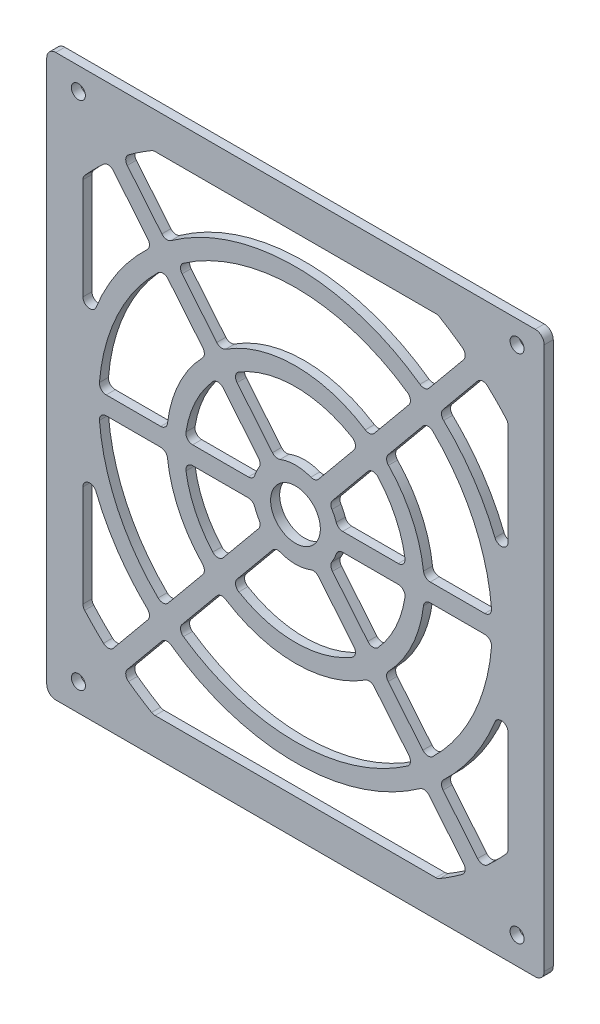
from build123d import *

# Parameters (mm, degrees)
SKETCH_1_W          = 110
SKETCH_1_H          = 124
EXTRUDE_1_DEPTH     = 2
SKETCH_3_R          = 1.55
CUT_EXTRUDE_1_DEPTH = 10
FILLET_2_R          = 2
SKETCH_5_R          = 43.5
SKETCH_5_R_2        = 28.5
SKETCH_5_R_3        = 24.5
SKETCH_5_R_4        = 9.5
SKETCH_5_R_5        = 5.5
CUT_EXTRUDE_4_DEPTH = 2
EXTRUDE_2_DEPTH     = 2
FILLET_3_R          = 1.5


with BuildPart() as part:
    # 草图1 → 凸台-拉伸1 (new body)
    with BuildSketch(Plane.XY):
        Rectangle(SKETCH_1_W, SKETCH_1_H)
    extrude(amount=EXTRUDE_1_DEPTH)

    # 草图3 → 切除-拉伸1 (cut)
    with BuildSketch(Plane.XY.offset(2)):
        with Locations((49, 57)):
            Circle(SKETCH_3_R)
        with Locations((-48, 57)):
            Circle(SKETCH_3_R)
        with Locations((-48, -56)):
            Circle(SKETCH_3_R)
        with Locations((49, -56)):
            Circle(SKETCH_3_R)
    extrude(amount=-CUT_EXTRUDE_1_DEPTH, mode=Mode.SUBTRACT)

    # 圆角2
    fillet_2_edges = [part.edges().sort_by_distance(p)[0] for p in [
        (55, -62, 1),
        (-55, -62, 1),
        (-55, 62, 1),
        (55, 62, 1),
    ]]
    fillet(fillet_2_edges, radius=FILLET_2_R)

    # 草图5 → 切除-拉伸4 (cut)
    # profile 1 of 5: a face of its own
    with BuildSketch(Plane.XY.offset(2)):
        with BuildLine():
            ThreePointArc((-31.468237955, 54), (-39.752872235, 48.228198692), (-47, 41.19769411))
            Line((-47, 41.19769411), (-47, 6.873863542))
            ThreePointArc((-47, 6.873863542), (0, 47.5), (47, 6.873863542))
            Line((47, 6.873863542), (47, 41.19769411))
            ThreePointArc((47, 41.19769411), (39.752872235, 48.228198692), (31.468237955, 54))
            Line((31.468237955, 54), (-31.468237955, 54))
        make_face()
    # profile 2 of 5: a face of its own
    with BuildSketch(Plane.XY.offset(2)):
        Circle(SKETCH_5_R)
        Circle(SKETCH_5_R_2, mode=Mode.SUBTRACT)
    # profile 3 of 5: a face of its own
    with BuildSketch(Plane.XY.offset(2)):
        Circle(SKETCH_5_R_3)
        Circle(SKETCH_5_R_4, mode=Mode.SUBTRACT)
    # profile 4 of 5: a face of its own
    with BuildSketch(Plane.XY.offset(2)):
        with BuildLine():
            Line((-47, -6.873863542), (-47, -41.19769411))
            ThreePointArc((-47, -41.19769411), (-39.752872235, -48.228198692), (-31.468237955, -54))
            Line((-31.468237955, -54), (31.468237955, -54))
            ThreePointArc((31.468237955, -54), (39.752872235, -48.228198692), (47, -41.19769411))
            Line((47, -41.19769411), (47, -6.873863542))
            ThreePointArc((47, -6.873863542), (0, -47.5), (-47, -6.873863542))
        make_face()
    # profile 5 of 5: a face of its own
    with BuildSketch(Plane.XY.offset(2)):
        Circle(SKETCH_5_R_5)
    extrude(amount=-CUT_EXTRUDE_4_DEPTH, mode=Mode.SUBTRACT)


with BuildPart() as cut_extrude_4_piece_1:
    # of the separate pieces the step leaves, piece 1, a body of its own (cut_extrude_4_pieces)
    add(part.part.solids().sort_by_distance((-53, -62, 0))[0])



with BuildPart() as cut_extrude_4_piece_2:
    # of the separate pieces the step leaves, piece 2, a body of its own (cut_extrude_4_pieces)
    add(part.part.solids().sort_by_distance((28.5, 0, 0))[0])


with BuildPart() as cut_extrude_4_piece_3:
    # of the separate pieces the step leaves, piece 3, a body of its own (cut_extrude_4_pieces)
    add(part.part.solids().sort_by_distance((9.5, 0, 0))[0])


with BuildPart() as cut_extrude_4_piece_1_1:
    add(cut_extrude_4_piece_1.part)

    add(cut_extrude_4_piece_2.part)  # 凸台-拉伸2 merges 切除-拉伸4 piece 2

    add(cut_extrude_4_piece_3.part)  # 凸台-拉伸2 merges 切除-拉伸4 piece 3
    # 草图6 → 凸台-拉伸2 (add)
    with BuildSketch(Plane.XY.offset(2)):
        with BuildLine():
            ThreePointArc((-29.182042471, -32.259237394), (-27.667999076, -33.566826289), (-26.095437755, -34.803421217))
            Line((-26.095437755, -34.803421217), (-1.715463439, -5.225627732))
            ThreePointArc((-1.715463439, -5.225627732), (-3.498252757, -4.244081485), (-4.802068155, -2.681443909))
            Line((-4.802068155, -2.681443909), (-29.182042471, -32.259237394))
        make_face()
        with BuildLine():
            ThreePointArc((-41.27581591, -46.931407618), (-39.752872235, -48.228198692), (-38.189211194, -49.475591441))
            Line((-38.189211194, -49.475591441), (-28.642087778, -37.893017928))
            ThreePointArc((-28.642087778, -37.893017928), (-30.212182899, -36.653431006), (-31.728692495, -35.348834105))
            Line((-31.728692495, -35.348834105), (-41.27581591, -46.931407618))
        make_face()
        with BuildLine():
            ThreePointArc((-43.453998665, 2), (-43.5, 0), (-43.453998665, -2))
            Line((-43.453998665, -2), (-5.5, -2))
            Line((-5.5, -2), (-5.5, 0))
            Line((-5.5, 0), (-5.5, 2))
            Line((-5.5, 2), (-43.453998665, 2))
        make_face()
        with BuildLine():
            Line((5.5, -2), (43.453998665, -2))
            ThreePointArc((43.453998665, -2), (43.488498146, -1.00026448), (43.5, 0))
            ThreePointArc((43.5, 0), (43.488498146, 1.00026448), (43.453998665, 2))
            Line((43.453998665, 2), (5.5, 2))
            Line((5.5, 2), (5.5, 0))
            Line((5.5, 0), (5.5, -2))
        make_face()
        with BuildLine():
            Line((1.715463439, -5.225627732), (26.095437755, -34.803421217))
            ThreePointArc((26.095437755, -34.803421217), (27.667999076, -33.566826289), (29.182042471, -32.259237394))
            Line((29.182042471, -32.259237394), (4.802068155, -2.681443909))
            ThreePointArc((4.802068155, -2.681443909), (3.498252757, -4.244081485), (1.715463439, -5.225627732))
        make_face()
        with BuildLine():
            ThreePointArc((31.728692495, -35.348834105), (30.212182899, -36.653431006), (28.642087778, -37.893017928))
            Line((28.642087778, -37.893017928), (38.189211194, -49.475591441))
            ThreePointArc((38.189211194, -49.475591441), (39.752872235, -48.228198692), (41.27581591, -46.931407618))
            Line((41.27581591, -46.931407618), (31.728692495, -35.348834105))
        make_face()
        with BuildLine():
            ThreePointArc((1.715463439, 5.225627732), (3.498252757, 4.244081485), (4.802068155, 2.681443909))
            Line((4.802068155, 2.681443909), (29.182042471, 32.259237394))
            ThreePointArc((29.182042471, 32.259237394), (27.667999076, 33.566826289), (26.095437755, 34.803421217))
            Line((26.095437755, 34.803421217), (1.715463439, 5.225627732))
        make_face()
        with BuildLine():
            ThreePointArc((28.642087778, 37.893017928), (30.212182899, 36.653431006), (31.728692495, 35.348834105))
            Line((31.728692495, 35.348834105), (41.27581591, 46.931407618))
            ThreePointArc((41.27581591, 46.931407618), (39.752872235, 48.228198692), (38.189211194, 49.475591441))
            Line((38.189211194, 49.475591441), (28.642087778, 37.893017928))
        make_face()
        with BuildLine():
            Line((-29.182042471, 32.259237394), (-4.802068155, 2.681443909))
            ThreePointArc((-4.802068155, 2.681443909), (-3.498252757, 4.244081485), (-1.715463439, 5.225627732))
            Line((-1.715463439, 5.225627732), (-26.095437755, 34.803421217))
            ThreePointArc((-26.095437755, 34.803421217), (-27.667999076, 33.566826289), (-29.182042471, 32.259237394))
        make_face()
        with BuildLine():
            Line((-41.27581591, 46.931407618), (-31.728692495, 35.348834105))
            ThreePointArc((-31.728692495, 35.348834105), (-30.212182899, 36.653431006), (-28.642087778, 37.893017928))
            Line((-28.642087778, 37.893017928), (-38.189211194, 49.475591441))
            ThreePointArc((-38.189211194, 49.475591441), (-39.752872235, 48.228198692), (-41.27581591, 46.931407618))
        make_face()
    extrude(amount=-EXTRUDE_2_DEPTH)

    # 圆角3
    fillet_3_edges = [cut_extrude_4_piece_1_1.edges().sort_by_distance(p)[0] for p in [
        (-9.287087811, -2, 1),
        (-9.287087811, 2, 1),
        (-24.418230894, 2, 1),
        (-28.429737952, -2, 1),
        (-24.418230894, -2, 1),
        (-28.429737952, 2, 1),
        (-43.453998665, 2, 1),
        (-43.453998665, -2, 1),
        (9.287087811, 2, 1),
        (9.287087811, -2, 1),
        (24.418230894, -2, 1),
        (28.429737952, 2, 1),
        (24.418230894, 2, 1),
        (28.429737952, -2, 1),
        (43.453998665, -2, 1),
        (43.453998665, 2, 1),
        (7.450317001, -5.894300348, 1),
        (4.363712285, -8.438484171, 1),
        (13.987814649, -20.114448572, 1),
        (19.625922206, -20.665748899, 1),
        (17.074419365, -17.570264749, 1),
        (16.53931749, -23.209932722, 1),
        (26.095437755, -34.803421217, 1),
        (29.182042471, -32.259237394, 1),
        (38.189211194, -49.475591441, 1),
        (41.27581591, -46.931407618, 1),
        (31.728692495, -35.348834105, 1),
        (28.642087778, -37.893017928, 1),
        (17.074419365, 17.570264749, 1),
        (7.450317001, 5.894300348, 1),
        (16.53931749, 23.209932722, 1),
        (13.987814649, 20.114448572, 1),
        (4.363712285, 8.438484171, 1),
        (19.625922206, 20.665748899, 1),
        (29.182042471, 32.259237394, 1),
        (26.095437755, 34.803421217, 1),
        (28.642087778, 37.893017928, 1),
        (38.189211194, 49.475591441, 1),
        (41.27581591, 46.931407618, 1),
        (31.728692495, 35.348834105, 1),
        (-17.074419365, 17.570264749, 1),
        (-7.450317001, 5.894300348, 1),
        (-16.53931749, 23.209932722, 1),
        (-13.987814649, 20.114448572, 1),
        (-4.363712285, 8.438484171, 1),
        (-19.625922206, 20.665748899, 1),
        (-29.182042471, 32.259237394, 1),
        (-26.095437755, 34.803421217, 1),
        (-38.189211194, 49.475591441, 1),
        (-28.642087778, 37.893017928, 1),
        (-31.728692495, 35.348834105, 1),
        (-41.27581591, 46.931407618, 1),
        (-26.095437755, -34.803421217, 1),
        (-29.182042471, -32.259237394, 1),
        (47, 41.19769411, 1),
        (-17.074419365, -17.570264749, 1),
        (-19.625922206, -20.665748899, 1),
        (31.468237955, 54, 1),
        (-31.468237955, 54, 1),
        (-13.987814649, -20.114448572, 1),
        (-16.53931749, -23.209932722, 1),
        (-47, 41.19769411, 1),
        (-47, 6.873863542, 1),
        (47, 6.873863542, 1),
        (-7.450317001, -5.894300348, 1),
        (-47, -41.19769411, 1),
        (-4.363712285, -8.438484171, 1),
        (-31.468237955, -54, 1),
        (31.468237955, -54, 1),
        (47, -41.19769411, 1),
        (-41.27581591, -46.931407618, 1),
        (-31.728692495, -35.348834105, 1),
        (-28.642087778, -37.893017928, 1),
        (-38.189211194, -49.475591441, 1),
        (47, -6.873863542, 1),
        (-47, -6.873863542, 1),
    ]]
    fillet(fillet_3_edges, radius=FILLET_3_R)


solid = cut_extrude_4_piece_1_1.part
